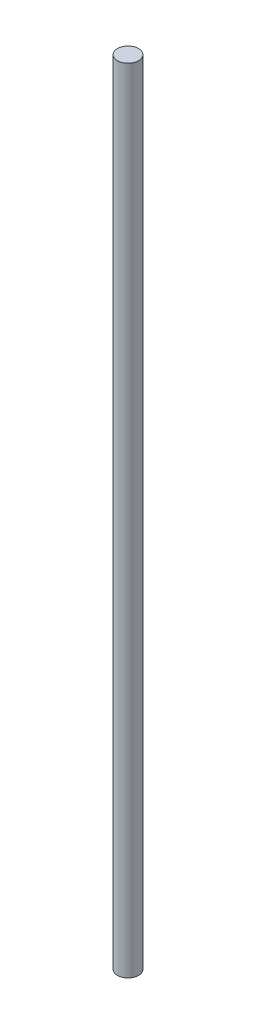
from build123d import *

# Parameters (mm, degrees)
SKETCH1_W = 5.08
SKETCH1_H = 381


with BuildPart() as part:
    # Sketch1 → Revolve1 (revolve)
    with BuildSketch(Plane.XY, mode=Mode.PRIVATE) as revolve1_sk:
        with Locations((2.54, 118.059868421)):
            Rectangle(SKETCH1_W, SKETCH1_H)
    revolve(revolve1_sk.sketch.rotate(Axis((0, -72.440131579, 0), (0, 1, 0)), 90), axis=Axis((0, -72.440131579, 0), (0, 1, 0)))


solid = part.part
